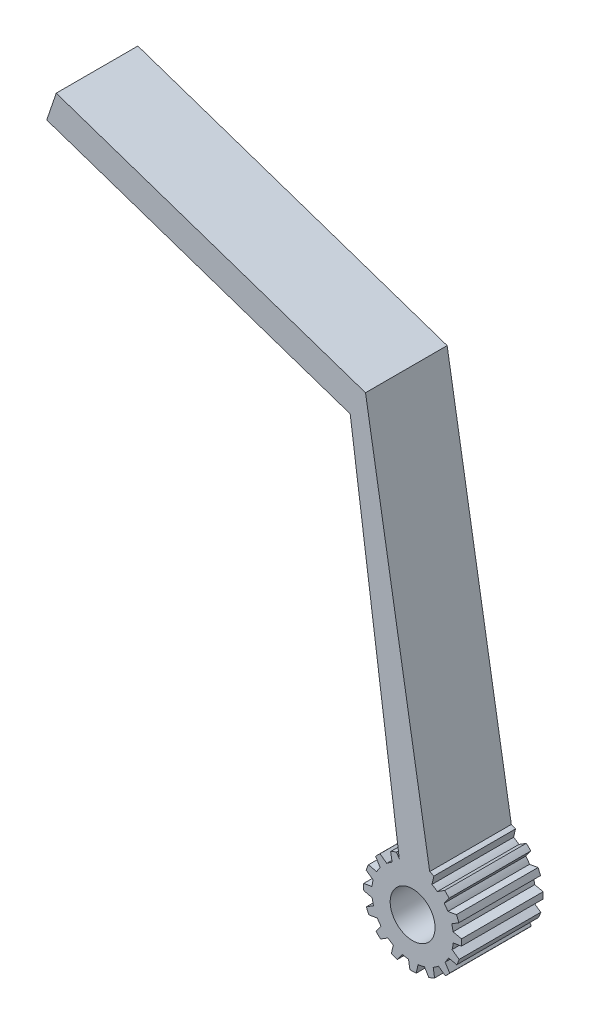
from build123d import *

# Parameters (mm, degrees)
SKETCH1_R           = 2.75
BOSS_EXTRUDE1_DEPTH = 10


with BuildPart() as part:
    # Sketch1 → Boss-Extrude1 (new body)
    with BuildSketch(Plane.XY):
        with BuildLine():
            Line((-5.771263161, 52.493232874), (2.09039449, 5.62407778))
            ThreePointArc((2.09039449, 5.62407778), (2.348768815, 5.521167001), (2.602096685, 5.4063937))
            Line((2.602096685, 5.4063937), (2.367387425, 4.404029607))
            ThreePointArc((2.367387425, 4.404029607), (2.707371965, 4.203586212), (3.030487733, 3.976951609))
            Line((3.030487733, 3.976951609), (3.922838506, 4.539971151))
            ThreePointArc((3.922838506, 4.539971151), (4.206602502, 4.278375322), (4.472961167, 3.999077193))
            Line((4.472961167, 3.999077193), (3.872529953, 3.162832869))
            ThreePointArc((3.872529953, 3.162832869), (4.109928346, 2.847540868), (4.321719082, 2.514506746))
            Line((4.321719082, 2.514506746), (5.361601948, 2.693181121))
            ThreePointArc((5.361601948, 2.693181121), (5.523657306, 2.342906308), (5.662857859, 1.982937436))
            Line((5.662857859, 1.982937436), (4.788114901, 1.440123498))
            ThreePointArc((4.788114901, 1.440123498), (4.886785392, 1.05798324), (4.955007877, 0.669251025))
            Line((4.955007877, 0.669251025), (5.984110097, 0.436378678))
            ThreePointArc((5.984110097, 0.436378678), (5.999785357, 0.050751048), (5.990635775, -0.335086571))
            Line((5.990635775, -0.335086571), (4.97475276, -0.501831621))
            ThreePointArc((4.97475276, -0.501831621), (4.919673661, -0.892642746), (4.833941641, -1.277892098))
            Line((4.833941641, -1.277892098), (5.695591729, -1.886858462))
            ThreePointArc((5.695591729, -1.886858462), (5.562500476, -2.2491306), (5.4063937, -2.602096685))
            Line((5.4063937, -2.602096685), (4.404029607, -2.367387425))
            ThreePointArc((4.404029607, -2.367387425), (4.203586212, -2.707371965), (3.976951609, -3.030487733))
            Line((3.976951609, -3.030487733), (4.539971151, -3.922838506))
            ThreePointArc((4.539971151, -3.922838506), (4.278375322, -4.206602502), (3.999077193, -4.472961167))
            Line((3.999077193, -4.472961167), (3.162832869, -3.872529953))
            ThreePointArc((3.162832869, -3.872529953), (2.847540868, -4.109928346), (2.514506746, -4.321719082))
            Line((2.514506746, -4.321719082), (2.693181121, -5.361601948))
            ThreePointArc((2.693181121, -5.361601948), (2.342906308, -5.523657306), (1.982937436, -5.662857859))
            Line((1.982937436, -5.662857859), (1.440123498, -4.788114901))
            ThreePointArc((1.440123498, -4.788114901), (1.05798324, -4.886785392), (0.669251025, -4.955007877))
            Line((0.669251025, -4.955007877), (0.436378678, -5.984110097))
            ThreePointArc((0.436378678, -5.984110097), (0.050751048, -5.999785357), (-0.335086571, -5.990635775))
            Line((-0.335086571, -5.990635775), (-0.501831621, -4.97475276))
            ThreePointArc((-0.501831621, -4.97475276), (-0.892642746, -4.919673661), (-1.277892098, -4.833941641))
            Line((-1.277892098, -4.833941641), (-1.886858462, -5.695591729))
            ThreePointArc((-1.886858462, -5.695591729), (-2.2491306, -5.562500476), (-2.602096685, -5.4063937))
            Line((-2.602096685, -5.4063937), (-2.367387425, -4.404029607))
            ThreePointArc((-2.367387425, -4.404029607), (-2.707371965, -4.203586212), (-3.030487733, -3.976951609))
            Line((-3.030487733, -3.976951609), (-3.922838506, -4.539971151))
            ThreePointArc((-3.922838506, -4.539971151), (-4.206602502, -4.278375322), (-4.472961167, -3.999077193))
            Line((-4.472961167, -3.999077193), (-3.872529953, -3.162832869))
            ThreePointArc((-3.872529953, -3.162832869), (-4.109928346, -2.847540868), (-4.321719082, -2.514506746))
            Line((-4.321719082, -2.514506746), (-5.361601948, -2.693181121))
            ThreePointArc((-5.361601948, -2.693181121), (-5.523657306, -2.342906308), (-5.662857859, -1.982937436))
            Line((-5.662857859, -1.982937436), (-4.788114901, -1.440123498))
            ThreePointArc((-4.788114901, -1.440123498), (-4.886785392, -1.05798324), (-4.955007877, -0.669251025))
            Line((-4.955007877, -0.669251025), (-5.984110097, -0.436378678))
            ThreePointArc((-5.984110097, -0.436378678), (-5.999785357, -0.050751048), (-5.990635775, 0.335086571))
            Line((-5.990635775, 0.335086571), (-4.97475276, 0.501831621))
            ThreePointArc((-4.97475276, 0.501831621), (-4.919673661, 0.892642746), (-4.833941641, 1.277892098))
            Line((-4.833941641, 1.277892098), (-5.695591729, 1.886858462))
            ThreePointArc((-5.695591729, 1.886858462), (-5.562500476, 2.2491306), (-5.4063937, 2.602096685))
            Line((-5.4063937, 2.602096685), (-4.404029607, 2.367387425))
            ThreePointArc((-4.404029607, 2.367387425), (-4.203586212, 2.707371965), (-3.976951609, 3.030487733))
            Line((-3.976951609, 3.030487733), (-4.539971151, 3.922838506))
            ThreePointArc((-4.539971151, 3.922838506), (-4.278375322, 4.206602502), (-3.999077193, 4.472961167))
            Line((-3.999077193, 4.472961167), (-3.162832869, 3.872529953))
            ThreePointArc((-3.162832869, 3.872529953), (-2.847540868, 4.109928346), (-2.514506746, 4.321719082))
            Line((-2.514506746, 4.321719082), (-2.693181121, 5.361601948))
            ThreePointArc((-2.693181121, 5.361601948), (-2.342906308, 5.523657306), (-1.982937436, 5.662857859))
            Line((-1.982937436, 5.662857859), (-1.630850624, 5.095471066))
            Line((-1.630850624, 5.095471066), (-1.721009902, 5.747880037))
            Line((-1.721009902, 5.747880037), (-7.647759844, 49.309063447))
            Line((-7.647759844, 49.309063447), (-44.816075509, 61.905592465))
            Line((-44.816075509, 61.905592465), (-43.65479695, 65.33215291))
            Line((-43.65479695, 65.33215291), (-5.771263161, 52.493232874))
        make_face()
        Circle(SKETCH1_R, mode=Mode.SUBTRACT)
    extrude(amount=BOSS_EXTRUDE1_DEPTH)


solid = part.part
